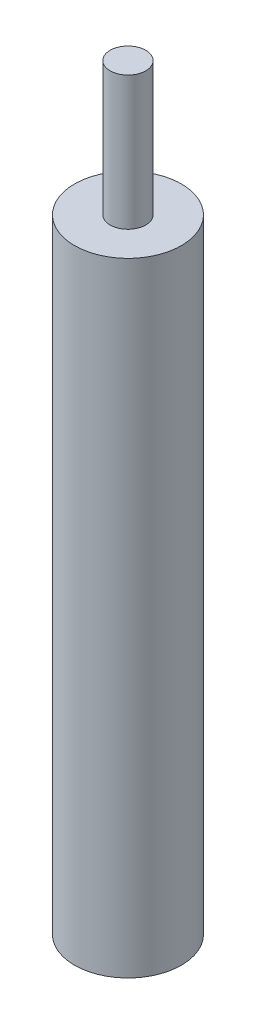
from build123d import *

# Parameters (mm, degrees)
SKETCH1_R        = 6
PROBE_BODY_DEPTH = 70
SKETCH2_R        = 0.8
PIN_WELLS_DEPTH  = 3
CABLE_STUB_START = 70
SKETCH3_R        = 2
CABLE_STUB_DEPTH = 15


with BuildPart() as part:
    # Sketch1 → Probe_Body (new body)
    with BuildSketch(Plane(origin=(0, 0, 0), x_dir=(1, 0, 0), z_dir=(0, 1, 0))):
        with Locations(Location((0, 0, 0), (0, 0, 270))):
            Circle(SKETCH1_R)
    extrude(amount=PROBE_BODY_DEPTH)

    # Sketch2 → Pin_Wells (cut)
    with BuildSketch(Plane(origin=(0, 0, 0), x_dir=(1, 0, 0), z_dir=(0, 1, 0))):
        with Locations(Location((-2.5, 0, 0), (0, 0, 270))):
            Circle(SKETCH2_R)
        with Locations(Location((2.5, 0, 0), (0, 0, 270))):
            Circle(SKETCH2_R)
    extrude(amount=PIN_WELLS_DEPTH, mode=Mode.SUBTRACT)

    # Sketch3 → Cable_Stub (add)
    with BuildSketch(Plane(origin=(0, 0, 0), x_dir=(1, 0, 0), z_dir=(0, 1, 0)).offset(CABLE_STUB_START)):
        with Locations(Location((0, 0, 0), (0, 0, 270))):
            Circle(SKETCH3_R)
    extrude(amount=CABLE_STUB_DEPTH)


solid = part.part
